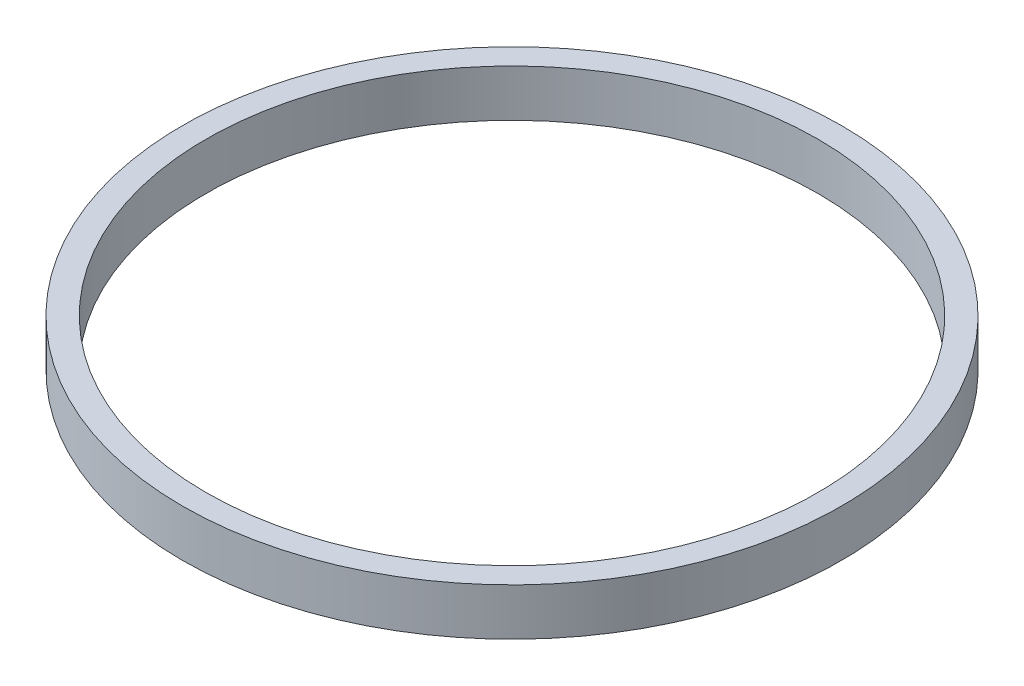
from build123d import *

# Parameters (mm, degrees)
SKETCH_1_R      = 21
SKETCH_1_R_2    = 19.5
EXTRUDE_1_DEPTH = 3


with BuildPart() as part:
    # Эскиз1 → Бобышка-Вытянуть1 (new body)
    with BuildSketch(Plane(origin=(0, 0, 0), x_dir=(1, 0, 0), z_dir=(0, 1, 0))):
        with Locations(Location((0, 0, 0), (0, 0, 270))):
            Circle(SKETCH_1_R)
        with Locations(Location((0, 0, 0), (0, 0, 270))):
            Circle(SKETCH_1_R_2, mode=Mode.SUBTRACT)
    extrude(amount=EXTRUDE_1_DEPTH)


solid = part.part
